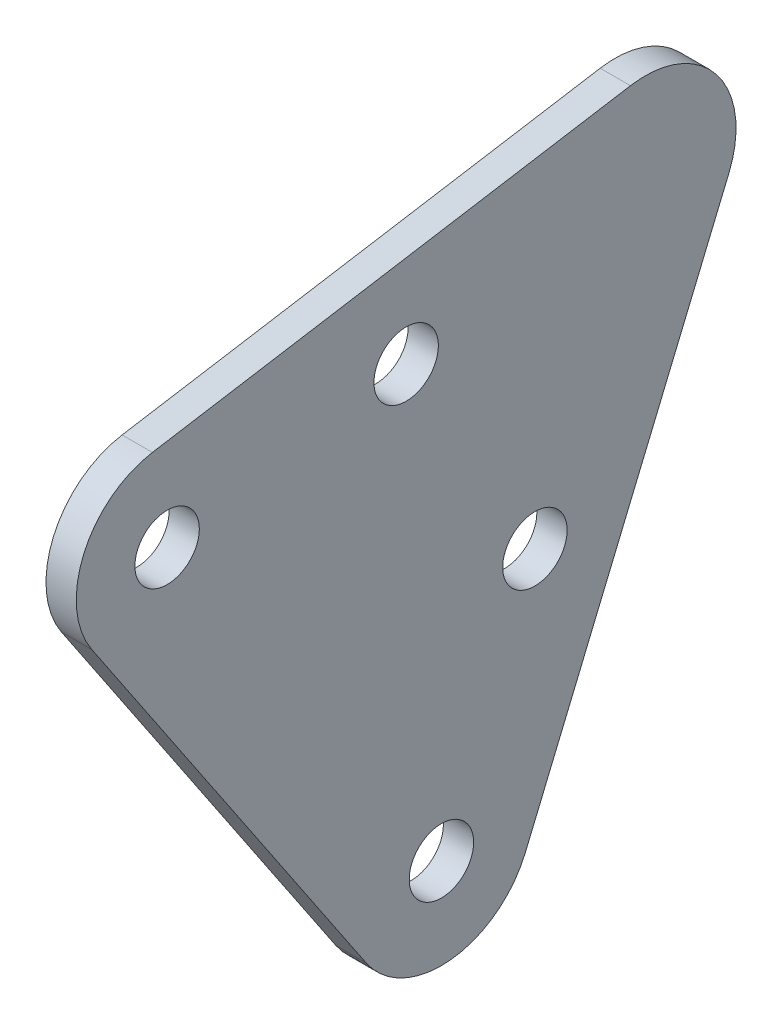
from build123d import *

# Parameters (mm, degrees)
BOSS_EXTRUDE1_START     = 92.868812
BOSS_EXTRUDE1_DEPTH     = 3.175
FILLET1_R               = 9.525
F_1_4_CLEARANCE_HOLE1_D = 6.7564


with BuildPart() as part:
    # Sketch2 → Boss-Extrude1 (new body)
    with BuildSketch(Plane(origin=(0, 0, 0), x_dir=(0, 0, -1), z_dir=(1, 0, 0)).offset(BOSS_EXTRUDE1_START)):
        with BuildLine():
            Line((-1159.986800073, 353.698023512), (-1134.923032257, 357.817191252))
            Line((-1134.923032257, 357.817191252), (-1092.891252047, 364.725009516))
            Line((-1092.891252047, 364.725009516), (-1111.090669966, 321.220387339))
            Line((-1111.090669966, 321.220387339), (-1120.893160292, 297.788119344))
            ThreePointArc((-1120.893160292, 297.788119344), (-1128.752566193, 291.984337623), (-1137.588017099, 296.1543437))
            Line((-1137.588017099, 296.1543437), (-1166.34986848, 338.989401064))
            ThreePointArc((-1166.34986848, 338.989401064), (-1167.184141053, 348.080982608), (-1159.986800073, 353.698023512))
        make_face()
    extrude(amount=BOSS_EXTRUDE1_DEPTH)

    # Fillet1
    fillet1_edges = [part.edges().sort_by_distance(p)[0] for p in [
        (94.456312, 364.725009516, 1092.891252047),
    ]]
    fillet(fillet1_edges, radius=FILLET1_R)

    # 1/4 Clearance Hole1 (through all)
    with Locations(Plane(origin=(96.043812484, 0, 0), x_dir=(0, 0, -1), z_dir=(1, 0, 0))):
        with Locations((-1133.378344355, 348.418278321), (-1158.442112171, 344.299110581), (-1129.68026079, 301.464053216), (-1119.877770464, 324.896321212)):
            Hole(F_1_4_CLEARANCE_HOLE1_D / 2)


solid = part.part
